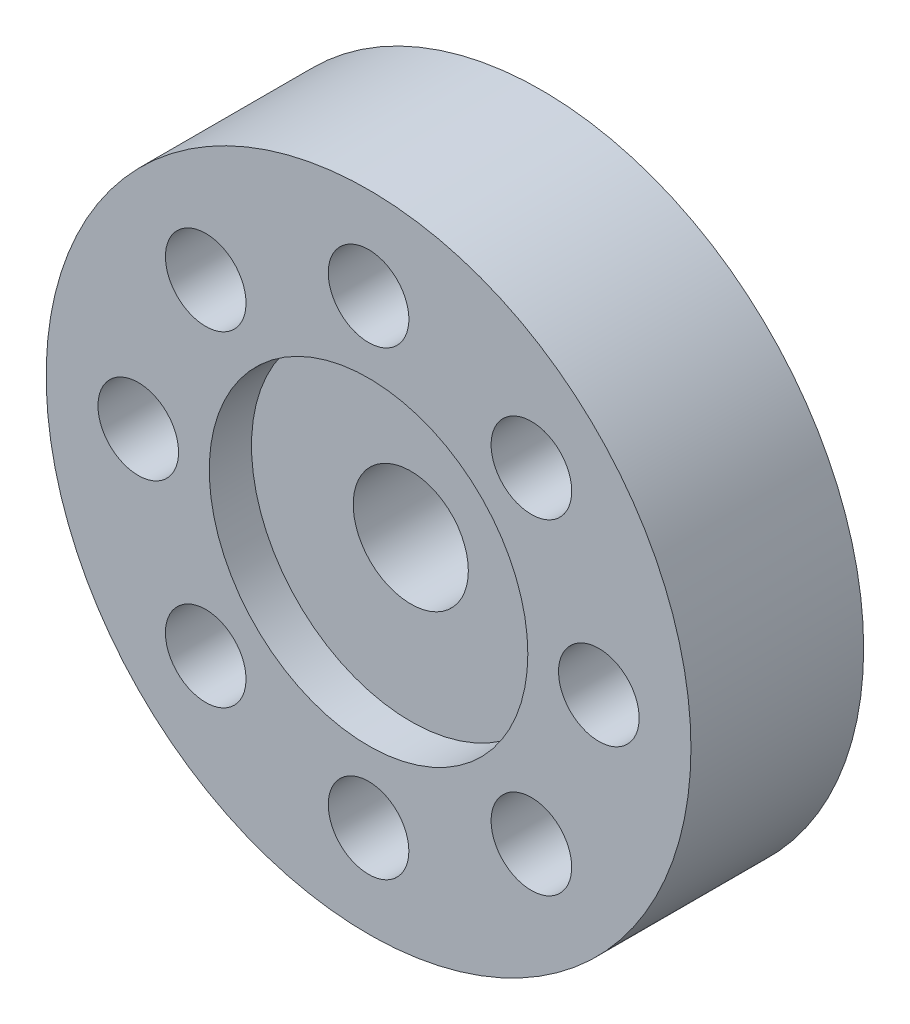
from build123d import *

# Parameters (mm, degrees)
SKETCH_3_R               = 1.05
CUT_EXTRUDE_1_DEPTH      = 13.703149216
PATTERN_CIRCULAR_1_COUNT = 8


with BuildPart() as part:
    # ｽｹｯﾁ2 → 回転1 (revolve)
    with BuildSketch(Plane(origin=(0, 0, 0), x_dir=(1, 0, 0), z_dir=(0, 1, 0))):
        Polygon((3.9, 0), (1.5, 0), (1.5, -4.2), (4.15, -4.2), (4.15, -5.3), (8.4, -5.3), (8.4, -0.8), (3.9, -0.8), align=None)
    revolve(axis=Axis((0, 0, 4.2), (0, 0, -1)))

    # ｽｹｯﾁ3 → ｶｯﾄ - 押し出し1 (cut, through all)
    with BuildSketch(Plane(origin=(0, 0, 0.8), x_dir=(-1, 0, 0), z_dir=(0, 0, -1))):
        with Locations((0, 6)):
            Circle(SKETCH_3_R)
    cut_extrude_1 = extrude(amount=-CUT_EXTRUDE_1_DEPTH, mode=Mode.SUBTRACT)

    # 円形ﾊﾟﾀｰﾝ1: ｶｯﾄ - 押し出し1 ×8 about axis
    pattern_circular_1_axis = Axis((0, 0, 0), (0, 0, 1))
    for i in range(1, PATTERN_CIRCULAR_1_COUNT):
        add(cut_extrude_1.rotate(pattern_circular_1_axis, i * 360 / PATTERN_CIRCULAR_1_COUNT), mode=Mode.SUBTRACT)


solid = part.part
